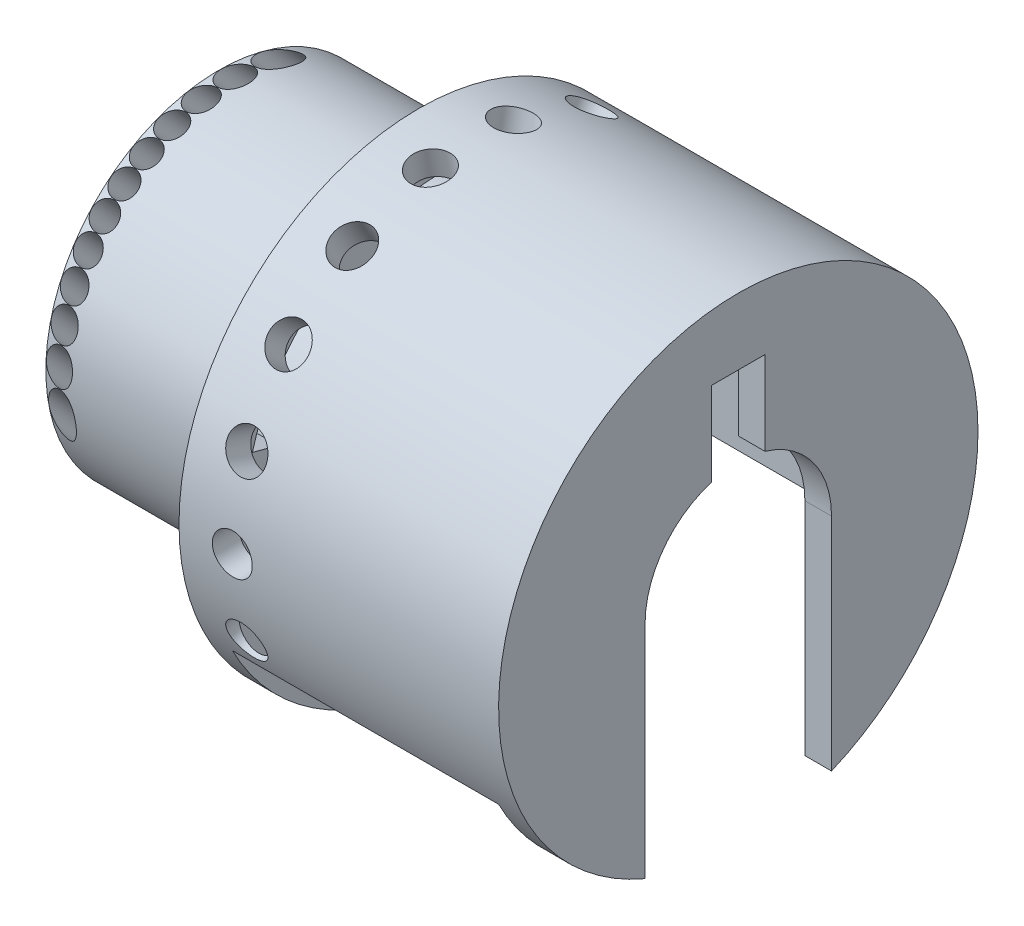
from build123d import *
from build123d.topology import SkipClean

# Parameters (mm, degrees)
SKETCH_2_W               = 7
SKETCH_2_H               = 10
SKETCH_2_W_2             = 2
SKETCH_2_H_2             = 3.5
CUT_EXTRUDE_1_DEPTH      = 11
SKETCH_3_W               = 10
SKETCH_3_H               = 16
CUT_EXTRUDE_2_DEPTH      = 10
SKETCH_5_R               = 0.75
CUT_EXTRUDE_4_DEPTH      = 10
PATTERN_CIRCULAR_2_COUNT = 18
SKETCH_7_R               = 0.49
CUT_EXTRUDE_5_DEPTH      = 10
CUT_EXTRUDE_START        = -1
CUT_EXTRUDE_6_DEPTH      = 1


with BuildPart() as part:
    # Эскиз1 → Повернуть1 (revolve)
    with BuildSketch(Plane.XY, mode=Mode.PRIVATE) as revolve_1_sk:
        Polygon((0, 0), (0, 6.5), (7.5, 6.5), (7.5, 9), (19.5, 9), (19.5, 3.5), (18.5, 3.5), (18.5, 8), (8.5, 8), (8.5, 5.5), (1, 5.5), (1, 0), align=None)
    revolve(revolve_1_sk.sketch.rotate(Axis((1, 0, 0), (-1, 0, 0)), 90), axis=Axis((1, 0, 0), (-1, 0, 0)))

    # Эскиз2 → Вырез-Вытянуть1 (cut)
    with BuildSketch(Plane(origin=(19.5, 0, 0), x_dir=(0, 0, -1), z_dir=(1, 0, 0))):
        with Locations((0, -5)):
            Rectangle(SKETCH_2_W, SKETCH_2_H)
        with Locations((0, 4.75)):
            Rectangle(SKETCH_2_W_2, SKETCH_2_H_2)
    extrude(amount=-CUT_EXTRUDE_1_DEPTH, mode=Mode.SUBTRACT)

    # Эскиз3 → Вырез-Вытянуть2 (cut)
    with BuildSketch(Plane(origin=(0, 0, 0), x_dir=(1, 0, 0), z_dir=(0, 1, 0))):
        with Locations((13.5, 0)):
            Rectangle(SKETCH_3_W, SKETCH_3_H)
    extrude(amount=-CUT_EXTRUDE_2_DEPTH, mode=Mode.SUBTRACT)

    # Эскиз5 → Вырез-Вытянуть4 (cut)
    with BuildSketch(Plane.XY):
        with Locations((9.5, 0)):
            Circle(SKETCH_5_R)
    cut_extrude_4 = extrude(amount=-CUT_EXTRUDE_4_DEPTH, mode=Mode.SUBTRACT)

    # Круговой массив2: Вырез-Вытянуть4 ×18 about axis
    pattern_circular_2_axis = Axis((0, 0, 0), (1, 0, 0))
    for i in range(1, PATTERN_CIRCULAR_2_COUNT):
        add(cut_extrude_4.rotate(pattern_circular_2_axis, i * 360 / PATTERN_CIRCULAR_2_COUNT), mode=Mode.SUBTRACT)

    # Эскиз7 → Вырез-Вытянуть5 (cut)
    with BuildSketch(Plane(origin=(0, 0, 0), x_dir=(1, 0, 0), z_dir=(0, 0.7313537016191722, 0.6819983600624967))):
        with Locations(Location((0.5, -5.5, 0), (0, 0, 90))):
            Circle(SKETCH_7_R)
        with Locations(Location((0.5, -4.5, 0), (0, 0, 90))):
            Circle(SKETCH_7_R)
        with Locations(Location((0.5, -3.5, 0), (0, 0, 90))):
            Circle(SKETCH_7_R)
        with Locations(Location((0.5, -2.5, 0), (0, 0, 90))):
            Circle(SKETCH_7_R)
        with Locations(Location((0.5, -1.5, 0), (0, 0, 90))):
            Circle(SKETCH_7_R)
        with Locations(Location((0.5, -0.5, 0), (0, 0, 90))):
            Circle(SKETCH_7_R)
        with Locations(Location((0.5, 0.5, 0), (0, 0, 90))):
            Circle(SKETCH_7_R)
        with Locations(Location((0.5, 1.5, 0), (0, 0, 90))):
            Circle(SKETCH_7_R)
        with Locations(Location((0.5, 2.5, 0), (0, 0, 90))):
            Circle(SKETCH_7_R)
        with Locations(Location((0.5, 3.5, 0), (0, 0, 90))):
            Circle(SKETCH_7_R)
        with Locations(Location((0.5, 4.5, 0), (0, 0, 90))):
            Circle(SKETCH_7_R)
        with Locations(Location((0.5, 5.5, 0), (0, 0, 90))):
            Circle(SKETCH_7_R)
    extrude(amount=CUT_EXTRUDE_5_DEPTH, mode=Mode.SUBTRACT)

    # Эскиз8 → Вырез-Вытянуть6 (cut)
    with SkipClean():  # the faces are left unmerged after this step: merging them gives an invalid solid
        with BuildSketch(Plane.ZY.offset(-7.5).offset(CUT_EXTRUDE_START)):
            with BuildLine():
                Line((-1.941142838, 7.244443697), (-1.682323793, 6.278517871))
                ThreePointArc((-1.682323793, 6.278517871), (0, 6.5), (1.682323793, 6.278517871))
                Line((1.682323793, 6.278517871), (1.941142838, 7.244443697))
                ThreePointArc((1.941142838, 7.244443697), (0, 7.5), (-1.941142838, 7.244443697))
            make_face()
            with BuildLine():
                Line((5.303300859, 5.303300859), (4.596194078, 4.596194078))
                ThreePointArc((4.596194078, 4.596194078), (5.629165125, 3.25), (6.278517871, 1.682323793))
                Line((6.278517871, 1.682323793), (7.244443697, 1.941142838))
                ThreePointArc((7.244443697, 1.941142838), (6.495190528, 3.75), (5.303300859, 5.303300859))
            make_face()
            with BuildLine():
                Line((7.244443697, -1.941142838), (6.278517871, -1.682323793))
                ThreePointArc((6.278517871, -1.682323793), (5.629165125, -3.25), (4.596194078, -4.596194078))
                Line((4.596194078, -4.596194078), (5.303300859, -5.303300859))
                ThreePointArc((5.303300859, -5.303300859), (6.495190528, -3.75), (7.244443697, -1.941142838))
            make_face()
            with BuildLine():
                Line((1.941142838, -7.244443697), (1.682323793, -6.278517871))
                ThreePointArc((1.682323793, -6.278517871), (0, -6.5), (-1.682323793, -6.278517871))
                Line((-1.682323793, -6.278517871), (-1.941142838, -7.244443697))
                ThreePointArc((-1.941142838, -7.244443697), (0, -7.5), (1.941142838, -7.244443697))
            make_face()
            with BuildLine():
                Line((-5.303300859, -5.303300859), (-4.596194078, -4.596194078))
                ThreePointArc((-4.596194078, -4.596194078), (-5.629165125, -3.25), (-6.278517871, -1.682323793))
                Line((-6.278517871, -1.682323793), (-7.244443697, -1.941142838))
                ThreePointArc((-7.244443697, -1.941142838), (-6.495190528, -3.75), (-5.303300859, -5.303300859))
            make_face()
            with BuildLine():
                Line((-7.244443697, 1.941142838), (-6.278517871, 1.682323793))
                ThreePointArc((-6.278517871, 1.682323793), (-5.629165125, 3.25), (-4.596194078, 4.596194078))
                Line((-4.596194078, 4.596194078), (-5.303300859, 5.303300859))
                ThreePointArc((-5.303300859, 5.303300859), (-6.495190528, 3.75), (-7.244443697, 1.941142838))
            make_face()
        extrude(amount=CUT_EXTRUDE_6_DEPTH, mode=Mode.SUBTRACT)


solid = part.part
